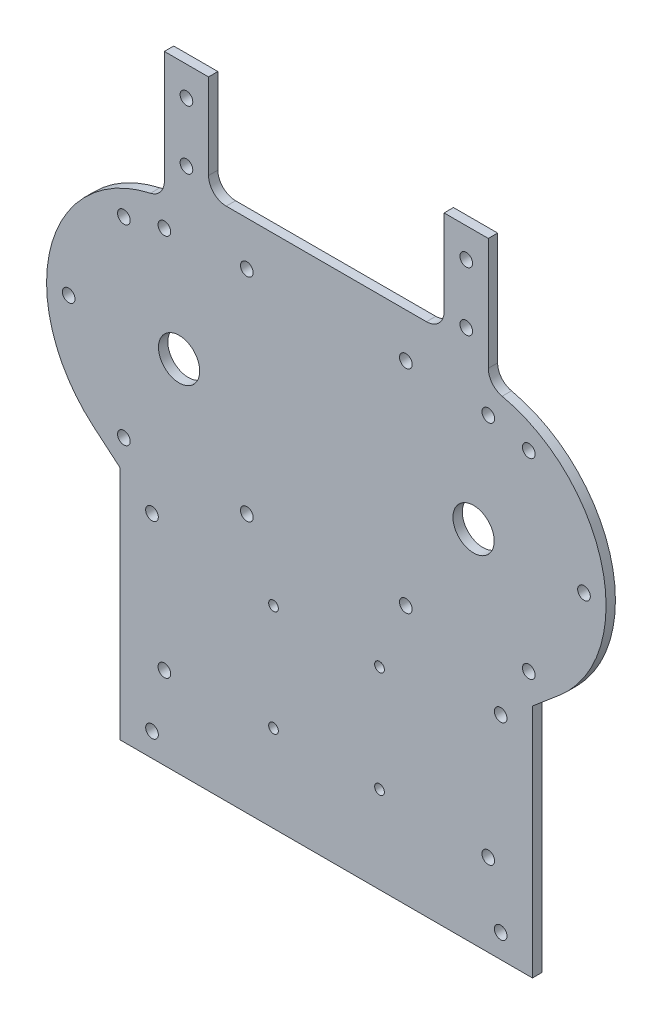
from build123d import *

# Parameters (mm, degrees)
SKETCH1_R           = 2.15
BOSS_EXTRUDE1_DEPTH = 3.175
SKETCH3_R           = 2.15
BOSS_EXTRUDE3_DEPTH = 3.175
BOSS_EXTRUDE4_DEPTH = 3.175
FILLET1_R           = 6
SKETCH5_R           = 7
CUT_EXTRUDE1_DEPTH  = 10
SKETCH6_R           = 1.65
CUT_EXTRUDE2_DEPTH  = 10
SKETCH7_R           = 2.15
CUT_EXTRUDE3_DEPTH  = 10
SKETCH8_R           = 2.15
CUT_EXTRUDE4_DEPTH  = 170.219031509


with BuildPart() as part:
    # Sketch1 → Boss-Extrude1 (new body)
    with BuildSketch(Plane.XY):
        Polygon((-40, 70), (-55, 70), (-55, -70), (55, -70), (55, 70), (40, 70), (40, 35), (-40, 35), align=None)
        with Locations((-27, -52)):
            Circle(SKETCH1_R, mode=Mode.SUBTRACT)
        with Locations((27, -52)):
            Circle(SKETCH1_R, mode=Mode.SUBTRACT)
        with Locations((-27, 20)):
            Circle(SKETCH1_R, mode=Mode.SUBTRACT)
        with Locations((-47.5, 40)):
            Circle(SKETCH1_R, mode=Mode.SUBTRACT)
        with Locations((-47.5, 60)):
            Circle(SKETCH1_R, mode=Mode.SUBTRACT)
        with Locations((27, 20)):
            Circle(SKETCH1_R, mode=Mode.SUBTRACT)
        with Locations((47.5, 40)):
            Circle(SKETCH1_R, mode=Mode.SUBTRACT)
        with Locations((47.5, 60)):
            Circle(SKETCH1_R, mode=Mode.SUBTRACT)
    extrude(amount=BOSS_EXTRUDE1_DEPTH)

    # Sketch3 → Boss-Extrude3 (add)
    # profile 1 of 2: a face of its own
    with BuildSketch(Plane.XY.offset(3.175)):
        with BuildLine():
            ThreePointArc((-55, 26.72135955), (-95, -18), (-55, -62.72135955))
            Line((-55, -62.72135955), (-55, 26.72135955))
        make_face()
        with Locations((-68.75, -50.475952642)):
            Circle(SKETCH3_R, mode=Mode.SUBTRACT)
        with Locations((-87.5, -18)):
            Circle(SKETCH3_R, mode=Mode.SUBTRACT)
        with Locations((-68.75, 14.475952642)):
            Circle(SKETCH3_R, mode=Mode.SUBTRACT)
    # profile 2 of 2: a face of its own
    with BuildSketch(Plane.XY.offset(3.175)):
        with BuildLine():
            Line((55, 26.72135955), (55, -62.72135955))
            ThreePointArc((55, -62.72135955), (95, -18), (55, 26.72135955))
        make_face()
        with Locations((68.75, -50.475952642)):
            Circle(SKETCH3_R, mode=Mode.SUBTRACT)
        with Locations((87.5, -18)):
            Circle(SKETCH3_R, mode=Mode.SUBTRACT)
        with Locations((68.75, 14.475952642)):
            Circle(SKETCH3_R, mode=Mode.SUBTRACT)
    extrude(amount=-BOSS_EXTRUDE3_DEPTH)

    # Sketch4 → Boss-Extrude4 (add)
    with BuildSketch(Plane.XY.offset(3.175)):
        with BuildLine():
            Line((-79.012371244, -52.398870836), (-70, -60))
            Line((-70, -60), (-70, -140))
            Line((-70, -140), (65, -140))
            Line((65, -140), (65, -60))
            Line((65, -60), (-38.978750739, -60))
            Line((-38.978750739, -60), (-37.516030877, -61.233673392))
            ThreePointArc((-37.516030877, -61.233673392), (-59.370723196, -62.013515501), (-79.012371244, -52.398870836))
        make_face()
    boss_extrude4 = extrude(amount=-BOSS_EXTRUDE4_DEPTH)

    # Mirror2: Boss-Extrude4 across plane
    add(boss_extrude4.mirror(Plane(origin=(0, 0, 0), x_dir=(0, 0, 1), z_dir=(1, 0, 0))))

    # Fillet1
    fillet1_edges = [part.edges().sort_by_distance(p)[0] for p in [
        (-40, 35, 1.5875),
        (40, 35, 1.5875),
        (-55, 26.72135955, 1.5875),
        (55, 26.72135955, 1.5875),
    ]]
    fillet(fillet1_edges, radius=FILLET1_R)

    # Sketch5 → Cut-Extrude1 (cut)
    with BuildSketch(Plane.XY.offset(3.175)):
        with Locations((-50, -18)):
            Circle(SKETCH5_R)
        with Locations((50, -18)):
            Circle(SKETCH5_R)
    extrude(amount=-CUT_EXTRUDE1_DEPTH, mode=Mode.SUBTRACT)

    # Sketch6 → Cut-Extrude2 (cut)
    with BuildSketch(Plane.XY.offset(3.175)):
        with Locations((-17.94, -110.5)):
            Circle(SKETCH6_R)
        with Locations((-17.94, -74.5)):
            Circle(SKETCH6_R)
        with Locations((18.06, -74.5)):
            Circle(SKETCH6_R)
        with Locations((18.06, -110.5)):
            Circle(SKETCH6_R)
    extrude(amount=-CUT_EXTRUDE2_DEPTH, mode=Mode.SUBTRACT)

    # Sketch7 → Cut-Extrude3 (cut)
    with BuildSketch(Plane.XY.offset(3.175)):
        with Locations((-55, 18)):
            Circle(SKETCH7_R)
        with Locations((55, 18)):
            Circle(SKETCH7_R)
        with Locations((55, -112)):
            Circle(SKETCH7_R)
        with Locations((-55, -112)):
            Circle(SKETCH7_R)
    extrude(amount=-CUT_EXTRUDE3_DEPTH, mode=Mode.SUBTRACT)

    # Sketch8 → Cut-Extrude4 (cut, through all)
    with BuildSketch(Plane.XY.offset(3.175)):
        with Locations((-59.2, -68)):
            Circle(SKETCH8_R)
        with Locations(Location((-59.2, -132, 0), (0, 0, 180))):
            Circle(SKETCH8_R)
        with Locations((59.2, -132)):
            Circle(SKETCH8_R)
        with Locations(Location((59.2, -68, 0), (0, 0, 180))):
            Circle(SKETCH8_R)
    extrude(amount=-CUT_EXTRUDE4_DEPTH, mode=Mode.SUBTRACT)


solid = part.part
